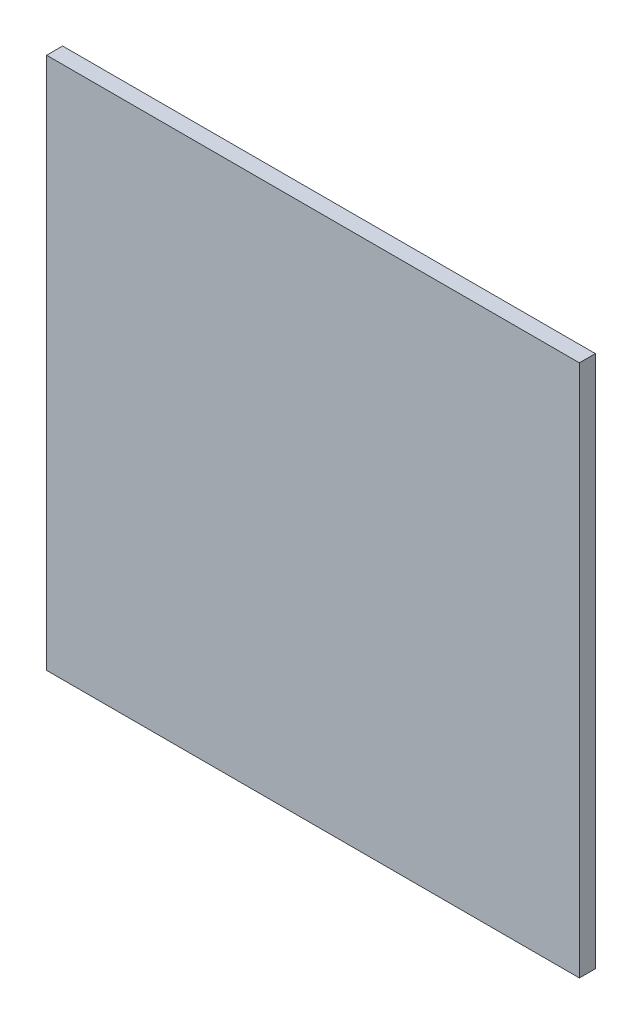
from build123d import *

# Parameters (mm, degrees)
SKETCH1_W           = 100
SKETCH1_H           = 100
BOSS_EXTRUDE1_DEPTH = 3


with BuildPart() as part:
    # Sketch1 → Boss-Extrude1 (new body)
    with BuildSketch(Plane.XY):
        Rectangle(SKETCH1_W, SKETCH1_H)
    extrude(amount=BOSS_EXTRUDE1_DEPTH)


solid = part.part
